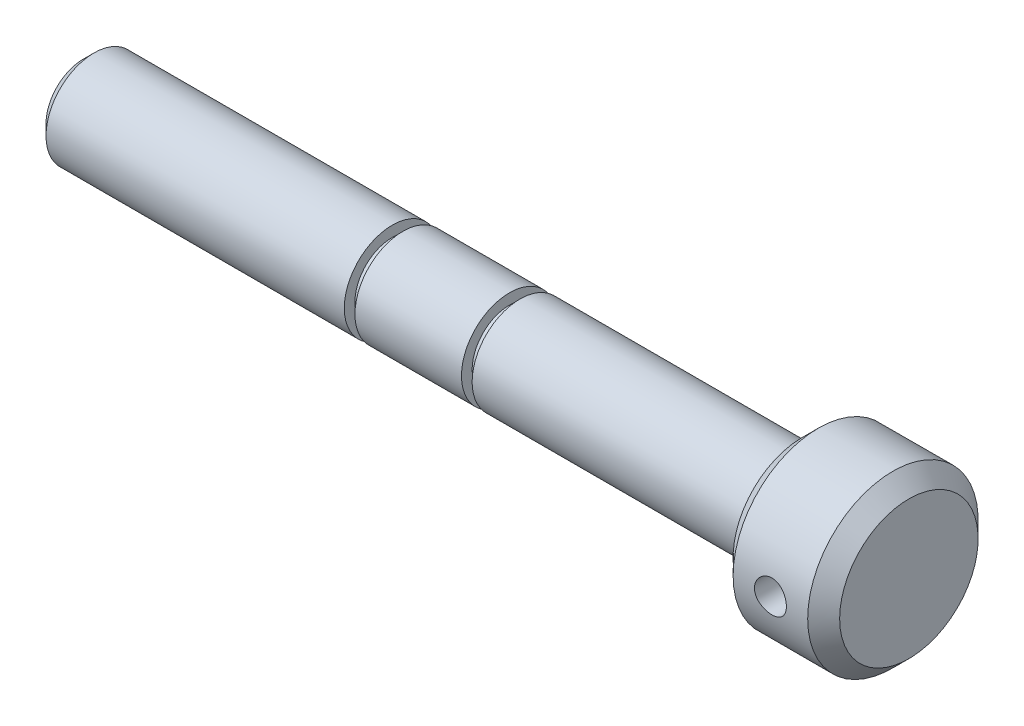
from build123d import *

# Parameters (mm, degrees)
CHAMFER1_SIZE       = 3
CHAMFER2_SIZE       = 2
SKETCH2_R           = 3
BOSS_EXTRUDE1_DEPTH = 5
SKETCH3_R           = 3
CUT_EXTRUDE1_DEPTH  = 200


with BuildPart() as part:
    # Sketch1 → Revolve1 (revolve)
    with BuildSketch(Plane.XY, mode=Mode.PRIVATE) as revolve1_sk:
        Polygon((155, 0), (155, 16), (135, 16), (135, 9), (82, 9), (82, 7), (80, 7), (80, 9), (60, 9), (60, 7), (58, 7), (58, 9), (0, 9), (0, 0), align=None)
    revolve(revolve1_sk.sketch.rotate(Axis((0, 0, 0), (1, 0, 0)), 90), axis=Axis((0, 0, 0), (1, 0, 0)))

    # Chamfer1
    chamfer1_edges = [part.edges().sort_by_distance(p)[0] for p in [
        (135, 0, -16),
        (155, 0, -16),
    ]]
    chamfer(chamfer1_edges, length=CHAMFER1_SIZE)

    # Chamfer2
    chamfer2_edges = [part.edges().sort_by_distance(p)[0] for p in [
        (0, 0, -9),
    ]]
    chamfer(chamfer2_edges, length=CHAMFER2_SIZE)

    # Sketch2 → Boss-Extrude1 (add, symmetric)
    with BuildSketch(Plane.XY):
        with Locations((145, 0)):
            Circle(SKETCH2_R)
    extrude(amount=BOSS_EXTRUDE1_DEPTH, both=True)

    # Sketch3 → Cut-Extrude1 (cut, symmetric)
    with BuildSketch(Plane.XY):
        with Locations((145, 0)):
            Circle(SKETCH3_R)
    extrude(amount=CUT_EXTRUDE1_DEPTH, both=True, mode=Mode.SUBTRACT)


solid = part.part
